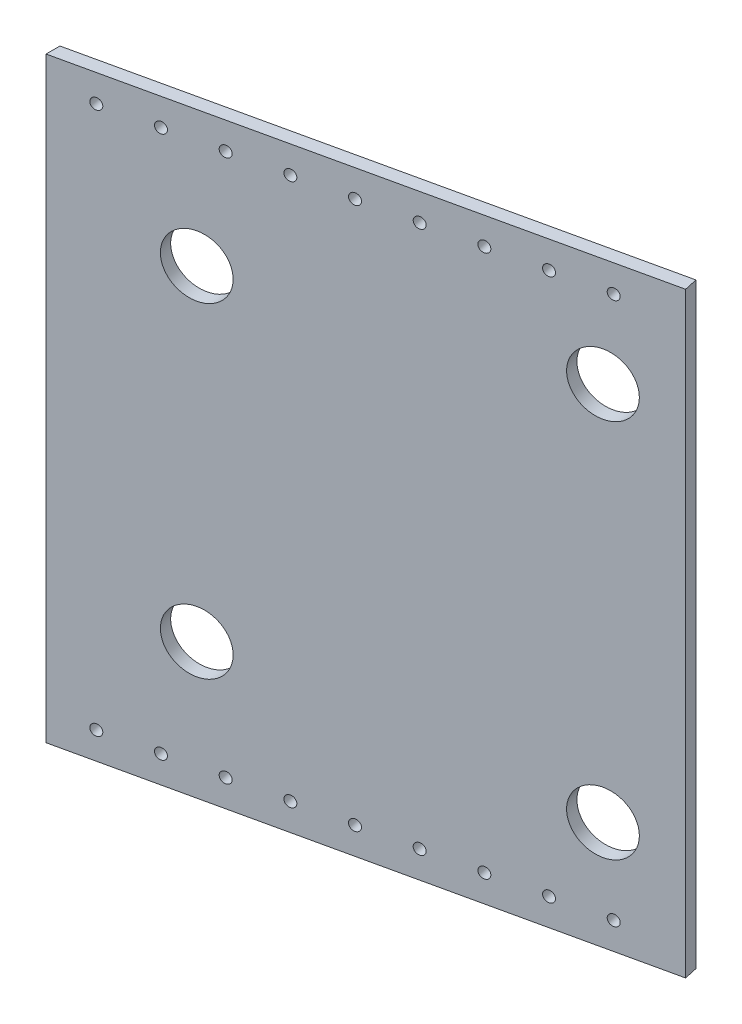
from build123d import *

# Parameters (mm, degrees)
SKETCH1_W                      = 278.13
SKETCH1_H                      = 251.191235252
BOSS_EXTRUDE1_DEPTH            = 6.35
DRAFT1_ANGLE                   = -12.5
HOLE1_D                        = 28.575
HOLE1_DEPTH                    = 59.131528827
F_7_0_201_DIAMETER_HOLE1_D     = 5.1054
F_7_0_201_DIAMETER_HOLE1_DEPTH = 59.131528827
BOSS_EXTRUDE2_DEPTH            = 1.27


with BuildPart() as part:
    # Sketch1 → Boss-Extrude1 (new body)
    with BuildSketch(Plane(origin=(191.25417179, 0, 862.691819056), x_dir=(0, 1, 0), z_dir=(0.21643961393810301, 0, 0.9762960071199335))):
        with Locations((145.415, -415.039419658)):
            Rectangle(SKETCH1_W, SKETCH1_H)
    extrude(amount=-BOSS_EXTRUDE1_DEPTH)

    # Draft1
    draft1_faces = [part.faces().sort_by_distance(p)[0] for p in [
        (473.149804226, 145.415, 796.944974464),
    ]]
    draft(draft1_faces, Plane(origin=(191.25417179, 0, 862.691819056), x_dir=(0.9762960071199334, 0, -0.21643961393810301), z_dir=(0.216439613938103, 0, 0.9762960071199333)), DRAFT1_ANGLE)

    # Hole1
    with Locations(Plane(origin=(191.25417179, 0, 862.691819056), x_dir=(0.976296007119934, 0, -0.21643961393809993), z_dir=(0.21643961393809993, 0, 0.9762960071199341))):
        with Locations((348.630068619, 222.25), (508.166081715, 234.95), (508.166081715, 57.15), (348.630068619, 69.85)):
            Hole(HOLE1_D / 2, depth=HOLE1_DEPTH)

    # #7 (0.201) Diameter Hole1
    with Locations(Plane(origin=(191.25417179, 0, 862.691819056), x_dir=(0.9762960071199334, 0, -0.216439613938103), z_dir=(0.21643961393810301, 0, 0.9762960071199335))):
        with Locations((359.982142032, 273.05), (410.782142032, 273.05), (461.582142032, 273.05), (512.382142032, 273.05), (486.982142032, 273.05), (436.182142032, 273.05), (385.382142032, 273.05), (334.582142032, 273.05), (512.382607571, 19.05), (486.982607571, 19.05), (461.582607571, 19.05), (436.182607571, 19.05), (410.782607571, 19.05), (385.382607571, 19.05), (359.982607571, 19.05), (334.582607571, 19.05), (309.182607571, 19.05), (309.182142032, 273.05)):
            Hole(F_7_0_201_DIAMETER_HOLE1_D / 2, depth=F_7_0_201_DIAMETER_HOLE1_DEPTH)

    # Sketch6 → Boss-Extrude2 (add)
    with BuildSketch(Plane(origin=(0, 284.48, 0), x_dir=(1, 0, 0), z_dir=(0, 1, 0))):
        Polygon((473.837, -800.044714287), (473.837, -793.540539371), (717.699608451, -739.477500659), (719.074, -745.676980304), align=None)
    extrude(amount=BOSS_EXTRUDE2_DEPTH)


solid = part.part
